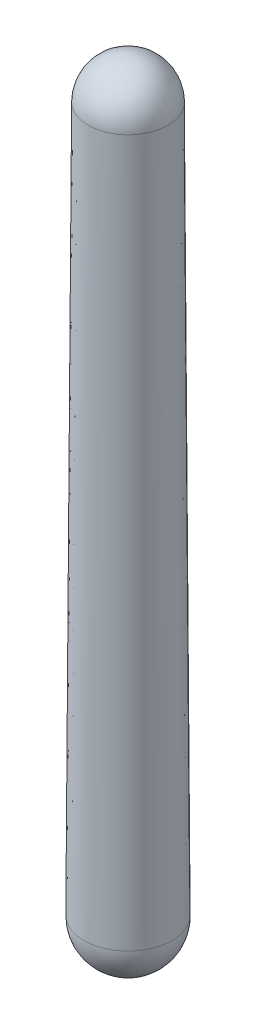
from build123d import *


with BuildPart() as part:
    # Sketch1 → Diafisis (revolve)
    with BuildSketch(Plane.XY, mode=Mode.PRIVATE) as diafisis_sk:
        Polygon((0, 0), (6.8, 0), (7.5, -120), (0, -120), align=None)
    revolve(diafisis_sk.sketch.rotate(Axis((0, -124, 0), (0, 1, 0)), 90), axis=Axis((0, -124, 0), (0, 1, 0)))

    # Sketch2 → Union_proximal (revolve)
    with BuildSketch(Plane.XY):
        with BuildLine():
            Line((0, -6.8), (0, 6.8))
            ThreePointArc((0, 6.8), (6.8, 0), (0, -6.8))
        make_face()
    revolve(axis=Axis((0, -10.8, 0), (0, 1, 0)))

    # Sketch3 → Union_distal (revolve)
    with BuildSketch(Plane.XY):
        with BuildLine():
            Line((0, -127.5), (0, -112.5))
            ThreePointArc((0, -112.5), (7.5, -120), (0, -127.5))
        make_face()
    revolve(axis=Axis((0, -131.5, 0), (0, 1, 0)))


solid = part.part
